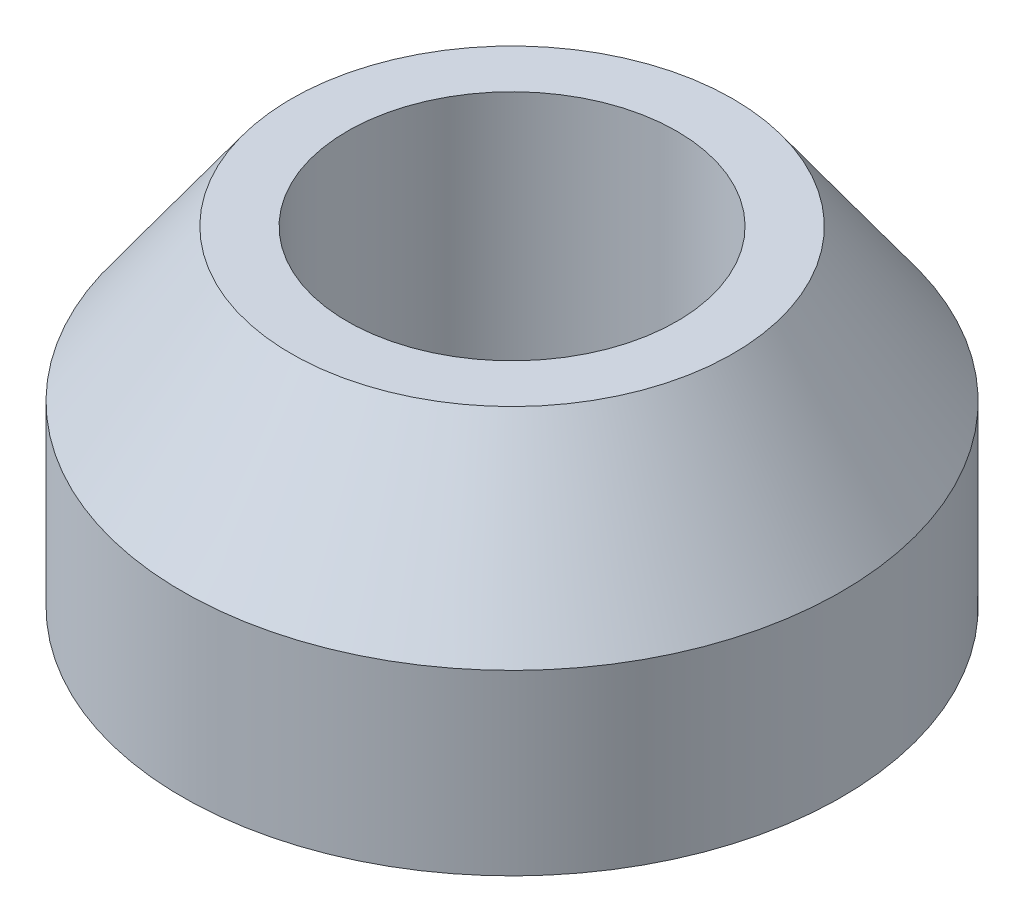
from build123d import *


with BuildPart() as part:
    # Sketch2 → Revolve1 (revolve)
    with BuildSketch(Plane(origin=(0, 0, 0), x_dir=(0, 0, -1), z_dir=(1, 0, 0))):
        Polygon((3.175, 0), (3.175, 6.35), (4.2545, 6.35), (6.35, 3.429), (6.35, 0), align=None)
    revolve(axis=Axis((0, 0, 0), (0, 1, 0)))


solid = part.part
